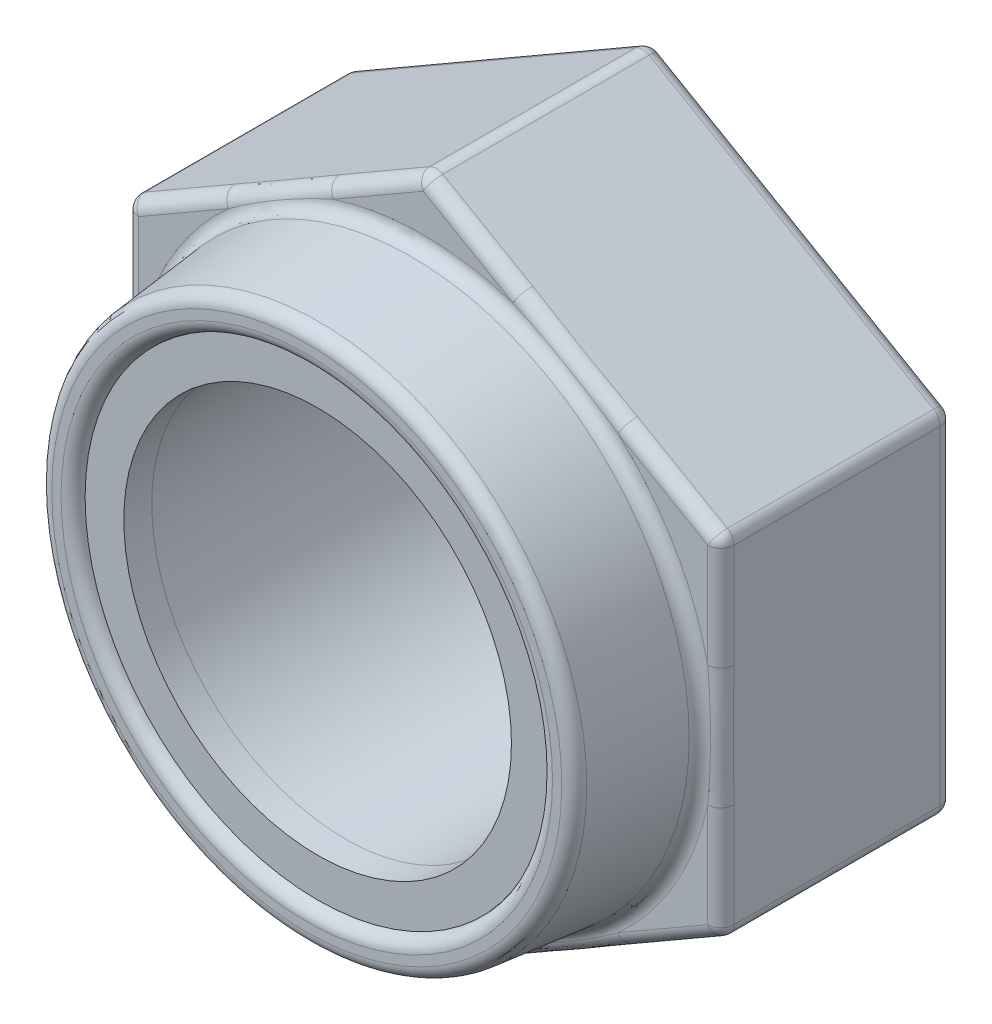
from build123d import *

# Parameters (mm, degrees)
BOSS_EXTRUDE1_DEPTH = 3
SKETCH2_R           = 3.6
BOSS_EXTRUDE2_DEPTH = 1.5
BOSS_EXTRUDE2_TAPER = 6
SKETCH3_R           = 2.5
CUT_EXTRUDE1_DEPTH  = 8.393993762
SKETCH4_R           = 3
CUT_EXTRUDE2_DEPTH  = 0.5
FILLET2_R           = 0.17
FILLET3_R           = 0.17
SKETCH5_R           = 3
BOSS_EXTRUDE4_DEPTH = 0.36
SKETCH8_R           = 2.5
CUT_EXTRUDE3_DEPTH  = 0.36
FILLET4_R           = 0.17
FILLET5_R           = 0.17


with BuildPart() as part:
    # Sketch1 → Boss-Extrude1 (new body)
    with BuildSketch(Plane.XY):
        Polygon((3.840822666, -2.2175), (3.840822666, 2.2175), (0, 4.435), (-3.840822666, 2.2175), (-3.840822666, -2.2175), (0, -4.435), align=None)
    extrude(amount=BOSS_EXTRUDE1_DEPTH)

    # Sketch2 → Boss-Extrude2 (add)
    with BuildSketch(Plane.XY.offset(3)):
        Circle(SKETCH2_R)
    extrude(amount=BOSS_EXTRUDE2_DEPTH, taper=BOSS_EXTRUDE2_TAPER)

    # Sketch3 → Cut-Extrude1 (cut, through all)
    with BuildSketch(Plane.XY.offset(4.5)):
        Circle(SKETCH3_R)
    extrude(amount=-CUT_EXTRUDE1_DEPTH, mode=Mode.SUBTRACT)

    # Sketch4 → Cut-Extrude2 (cut)
    with BuildSketch(Plane.XY.offset(4.5)):
        Circle(SKETCH4_R)
    extrude(amount=-CUT_EXTRUDE2_DEPTH, mode=Mode.SUBTRACT)

    # Fillet2
    fillet2_edges = [part.edges().sort_by_distance(p)[0] for p in [
        (-3.442343647, 0, 4.5),
    ]]
    fillet(fillet2_edges, radius=FILLET2_R)

    # Fillet3
    fillet3_edges = [part.edges().sort_by_distance(p)[0] for p in [
        (-3, 0, 4.5),
    ]]
    fillet(fillet3_edges, radius=FILLET3_R)

    # Fillet4
    fillet4_edges = [part.edges().sort_by_distance(p)[0] for p in [
        (-3.6, 0, 3),
    ]]
    fillet(fillet4_edges, radius=FILLET4_R)

    # Fillet5
    fillet5_edges = [part.edges().sort_by_distance(p)[0] for p in [
        (1.920411333, 3.32625, 3),
        (0, -4.435, 1.5),
        (-3.840822666, -2.2175, 1.5),
        (-3.840822666, 2.2175, 1.5),
        (0, 4.435, 1.5),
        (3.840822666, 2.2175, 1.5),
        (3.840822666, -2.2175, 1.5),
        (-1.920411333, 3.32625, 3),
        (-3.840822666, 0, 3),
        (-1.920411333, -3.32625, 3),
        (1.920411333, -3.32625, 3),
        (-1.920411333, -3.32625, 0),
        (-3.840822666, 0, 0),
        (-1.920411333, 3.32625, 0),
        (3.840822666, 0, 3),
        (1.920411333, 3.32625, 0),
        (3.840822666, 0, 0),
        (1.920411333, -3.32625, 0),
    ]]
    fillet(fillet5_edges, radius=FILLET5_R)


with BuildPart() as body_2:
    # Sketch5 → Boss-Extrude4 (new body)
    with BuildSketch(Plane.XY.offset(4)):
        with Locations(Location((0, 0, 0), (0, 0, 180))):
            Circle(SKETCH5_R)
    extrude(amount=BOSS_EXTRUDE4_DEPTH)

    # Sketch8 → Cut-Extrude3 (cut)
    with BuildSketch(Plane.XY.offset(4.36)):
        Circle(SKETCH8_R)
    extrude(amount=-CUT_EXTRUDE3_DEPTH, mode=Mode.SUBTRACT)


solid = Compound([part.part, body_2.part])
